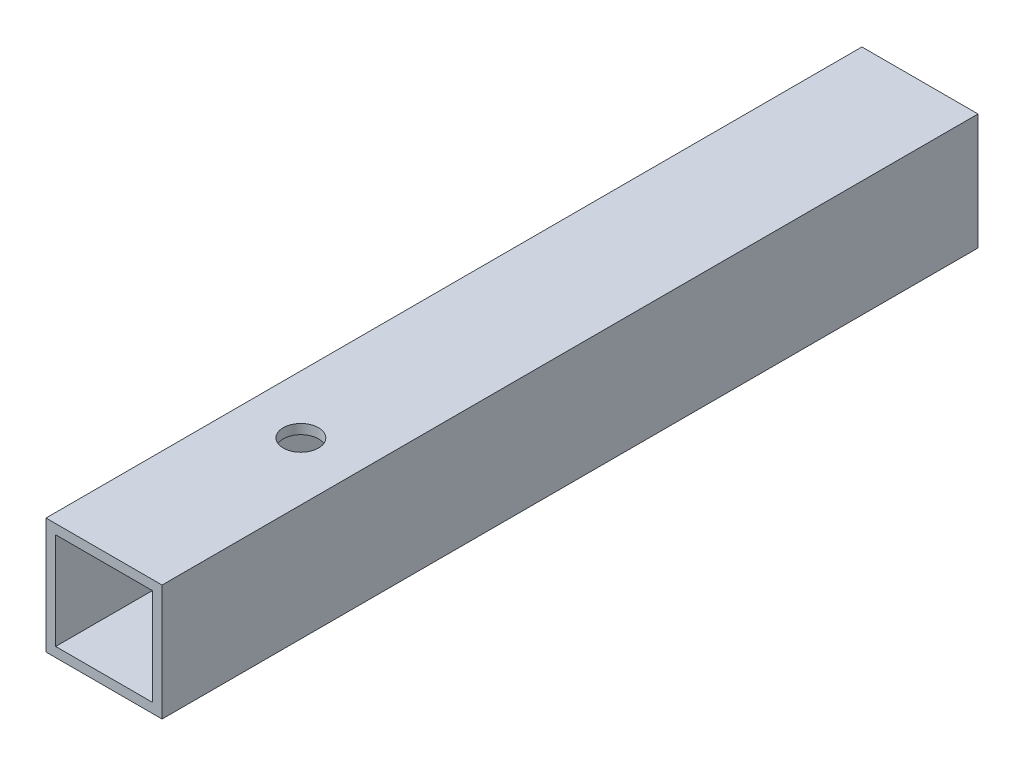
from build123d import *

# Parameters (mm, degrees)
SKETCH1_W                = 19.05
SKETCH1_H                = 19.05
SKETCH1_W_2              = 15.875
SKETCH1_H_2              = 15.875
BOSS_EXTRUDE1_DEPTH      = 66.951599904
SKETCH2_R                = 2.8956
BASEPLATEMOUNTHOLE_DEPTH = 71.25770317


with BuildPart() as part:
    # Sketch1 → Boss-Extrude1 (new, symmetric)
    with BuildSketch(Plane(origin=(0, 0, 0), x_dir=(0, -1, 0), z_dir=(0, 0, 1))):
        Rectangle(SKETCH1_W, SKETCH1_H)
        Rectangle(SKETCH1_W_2, SKETCH1_H_2, mode=Mode.SUBTRACT)
    extrude(amount=BOSS_EXTRUDE1_DEPTH, both=True)

    # Sketch2 → BasePlateMountHole (cut, through all)
    with BuildSketch(Plane(origin=(0, 9.525, 0), x_dir=(1, 0, 0), z_dir=(0, 1, 0))):
        with Locations(Location((0, -34.648400096, 0), (0, 0, 180))):
            Circle(SKETCH2_R)
    extrude(amount=-BASEPLATEMOUNTHOLE_DEPTH, mode=Mode.SUBTRACT)


solid = part.part
